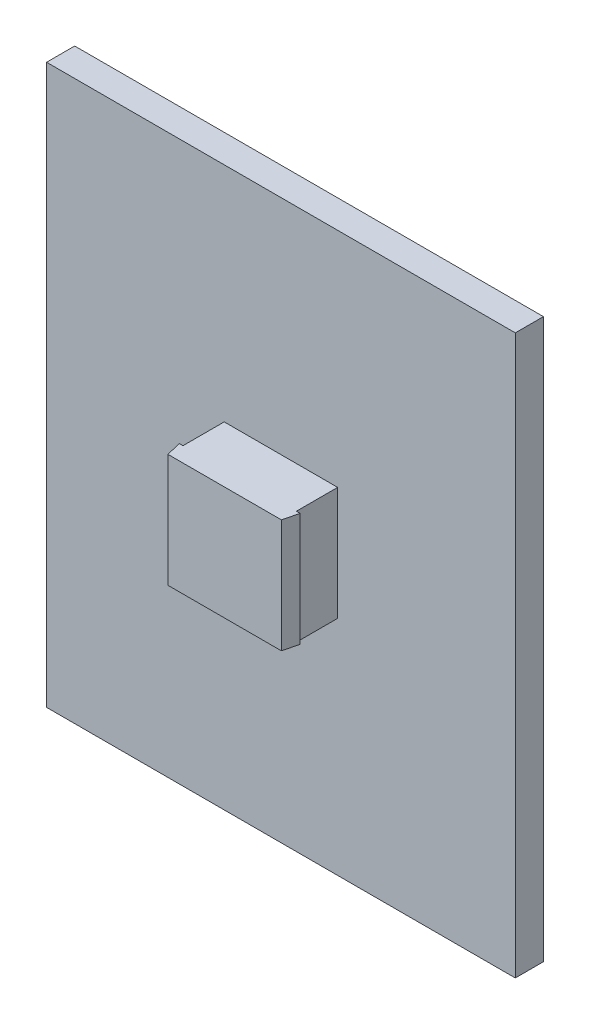
from build123d import *

# Parameters (mm, degrees)
SKETCH2_W           = 29.8
SKETCH2_H           = 25
BOSS_EXTRUDE1_DEPTH = 1.5
SKETCH3_W           = 6.05
SKETCH3_H           = 6.05
BOSS_EXTRUDE2_DEPTH = 3
BOSS_EXTRUDE3_DEPTH = 6.05


with BuildPart() as part:
    # Sketch2 → Boss-Extrude1 (new body)
    with BuildSketch(Plane(origin=(0, 0, 0), x_dir=(0, 1, 0), z_dir=(0, 0, 1))):
        Rectangle(SKETCH2_W, SKETCH2_H)
    extrude(amount=BOSS_EXTRUDE1_DEPTH)

    # Sketch3 → Boss-Extrude2 (add)
    with BuildSketch(Plane.XY.offset(1.5)):
        Rectangle(SKETCH3_W, SKETCH3_H)
    extrude(amount=BOSS_EXTRUDE2_DEPTH)

    # Sketch4 → Boss-Extrude3 (add)
    with BuildSketch(Plane(origin=(0, 3.025, 0), x_dir=(-1, 0, 0), z_dir=(0, 1, 0))):
        Polygon((-3.025, 4.5), (-3.025, 3.7), (-3.225, 3.7), align=None)
        Polygon((3.225, 3.7), (3.025, 4.5), (3.025, 3.7), align=None)
    extrude(amount=-BOSS_EXTRUDE3_DEPTH)


solid = part.part
